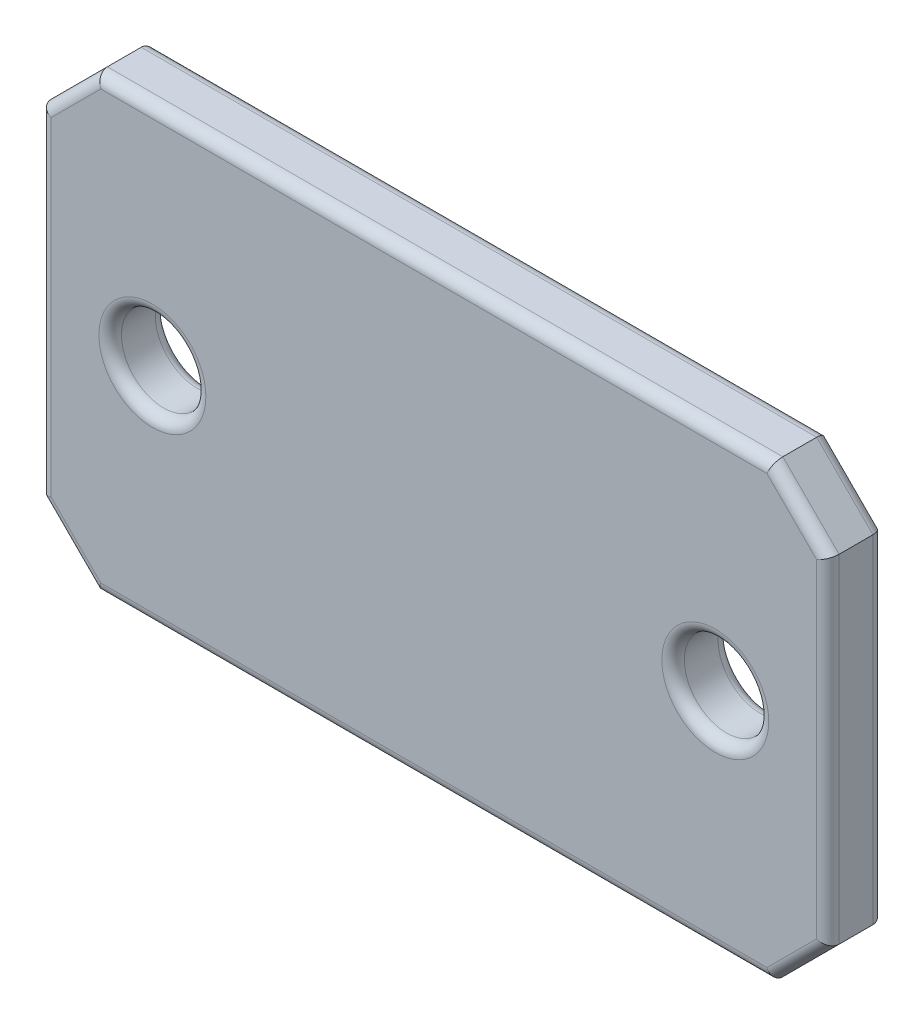
from build123d import *

# Parameters (mm, degrees)
BOSS_EXTRUDE1_DEPTH            = 3.175
F_3_16_0_1875_DIAMETER_HOLE1_D = 4.7625
FILLET1_R                      = 0.635


with BuildPart() as part:
    # Sketch1 → Boss-Extrude1 (new body)
    with BuildSketch(Plane.XY):
        Polygon((19.05, 12.7), (-19.05, 12.7), (-22.225, 9.525), (-22.225, -9.525), (-19.05, -12.7), (19.05, -12.7), (22.225, -9.525), (22.225, 9.525), align=None)
    extrude(amount=BOSS_EXTRUDE1_DEPTH)

    # 3/16 (0.1875) Diameter Hole1 (through all)
    with Locations(Plane.XY.offset(3.175)):
        with Locations((15.875, 0), (-15.875, 0)):
            Hole(F_3_16_0_1875_DIAMETER_HOLE1_D / 2)

    # Fillet1
    fillet1_edges = [part.edges().sort_by_distance(p)[0] for p in [
        (-20.6375, 11.1125, 3.175),
        (0, 12.7, 0),
        (20.6375, 11.1125, 0),
        (-22.225, 0, 3.175),
        (-20.6375, -11.1125, 3.175),
        (0, -12.7, 3.175),
        (20.6375, -11.1125, 3.175),
        (22.225, 0, 3.175),
        (-13.49375, 0, 3.175),
        (-13.49375, 0, 0),
        (18.25625, 0, 3.175),
        (18.25625, 0, 0),
        (20.6375, 11.1125, 3.175),
        (0, 12.7, 3.175),
        (22.225, 0, 0),
        (20.6375, -11.1125, 0),
        (0, -12.7, 0),
        (-20.6375, -11.1125, 0),
        (-22.225, 0, 0),
        (-20.6375, 11.1125, 0),
    ]]
    fillet(fillet1_edges, radius=FILLET1_R)


solid = part.part
